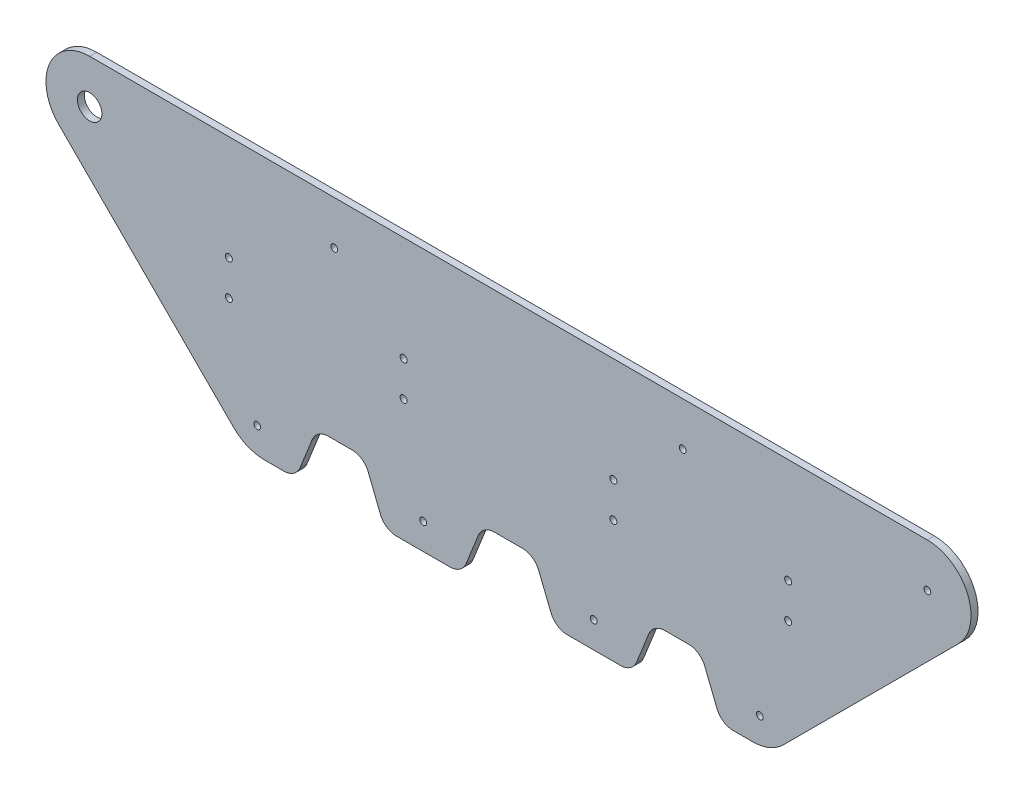
from build123d import *

# Parameters (mm, degrees)
SKETCH_1_R          = 1.95
SKETCH_1_R_2        = 7
EXTRUDE_1_DEPTH     = 4
SKETCH_2_R          = 2
CUT_EXTRUDE_1_DEPTH = 10
CUT_EXTRUDE_2_DEPTH = 10
FILLET_1_R          = 10


with BuildPart() as part:
    # 草图1 → 凸台-拉伸1 (new body)
    with BuildSketch(Plane.XY):
        with BuildLine():
            Line((-7.32233047, 7.32233047), (-107.32233047, 107.32233047))
            ThreePointArc((-107.32233047, 107.32233047), (-112.741649253, 134.567085809), (-89.644660941, 150))
            Line((-89.644660941, 150), (389.644660941, 150))
            ThreePointArc((389.644660941, 150), (412.741649253, 134.567085809), (407.32233047, 107.32233047))
            Line((407.32233047, 107.32233047), (307.32233047, 7.32233047))
            ThreePointArc((307.32233047, 7.32233047), (299.21174675, 1.903011687), (289.644660941, 0))
            Line((289.644660941, 0), (10.355339059, 0))
            ThreePointArc((10.355339059, 0), (0.78825325, 1.903011687), (-7.32233047, 7.32233047))
        make_face()
        with Locations((50.355339059, 125)):
            Circle(SKETCH_1_R, mode=Mode.SUBTRACT)
        with Locations((249.644660941, 125)):
            Circle(SKETCH_1_R, mode=Mode.SUBTRACT)
        with Locations((101.213203436, 15)):
            Circle(SKETCH_1_R, mode=Mode.SUBTRACT)
        with Locations((198.786796564, 15)):
            Circle(SKETCH_1_R, mode=Mode.SUBTRACT)
        with Locations((-89.644660941, 125)):
            Circle(SKETCH_1_R_2, mode=Mode.SUBTRACT)
        with Locations((6.213203436, 15)):
            Circle(SKETCH_1_R, mode=Mode.SUBTRACT)
        with Locations((293.786796564, 15)):
            Circle(SKETCH_1_R, mode=Mode.SUBTRACT)
        with Locations((389.644660941, 125)):
            Circle(SKETCH_1_R, mode=Mode.SUBTRACT)
    extrude(amount=EXTRUDE_1_DEPTH)

    # 草图2 → 切除-拉伸1 (cut)
    with BuildSketch(Plane.XY.offset(4)):
        with Locations((-10, 90)):
            Circle(SKETCH_2_R)
        with Locations((90, 90)):
            Circle(SKETCH_2_R)
        with Locations((210, 90)):
            Circle(SKETCH_2_R)
        with Locations((310, 90)):
            Circle(SKETCH_2_R)
        with Locations((-10, 70)):
            Circle(SKETCH_2_R)
        with Locations((90, 70)):
            Circle(SKETCH_2_R)
        with Locations((210, 70)):
            Circle(SKETCH_2_R)
        with Locations((310, 70)):
            Circle(SKETCH_2_R)
    extrude(amount=-CUT_EXTRUDE_1_DEPTH, mode=Mode.SUBTRACT)

    # 草图3 → 切除-拉伸2 (cut)
    with BuildSketch(Plane.XY.offset(4)):
        Polygon((28.213203436, 0), (40.213203436, 30), (67.213203436, 30), (79.213203436, 0), align=None)
        Polygon((123.213203436, 0), (135.213203436, 30), (164.786796564, 30), (176.786796564, 0), align=None)
        Polygon((220.786796564, 0), (232.786796564, 30), (259.786796564, 30), (271.786796564, 0), align=None)
    extrude(amount=-CUT_EXTRUDE_2_DEPTH, mode=Mode.SUBTRACT)

    # 圆角1
    fillet_1_edges = [part.edges().sort_by_distance(p)[0] for p in [
        (271.786796564, 0, 2),
        (220.786796564, 0, 2),
        (176.786796564, 0, 2),
        (123.213203436, 0, 2),
        (79.213203436, 0, 2),
        (28.213203436, 0, 2),
        (40.213203436, 30, 2),
        (67.213203436, 30, 2),
        (135.213203436, 30, 2),
        (164.786796564, 30, 2),
        (232.786796564, 30, 2),
        (259.786796564, 30, 2),
    ]]
    fillet(fillet_1_edges, radius=FILLET_1_R)


solid = part.part
